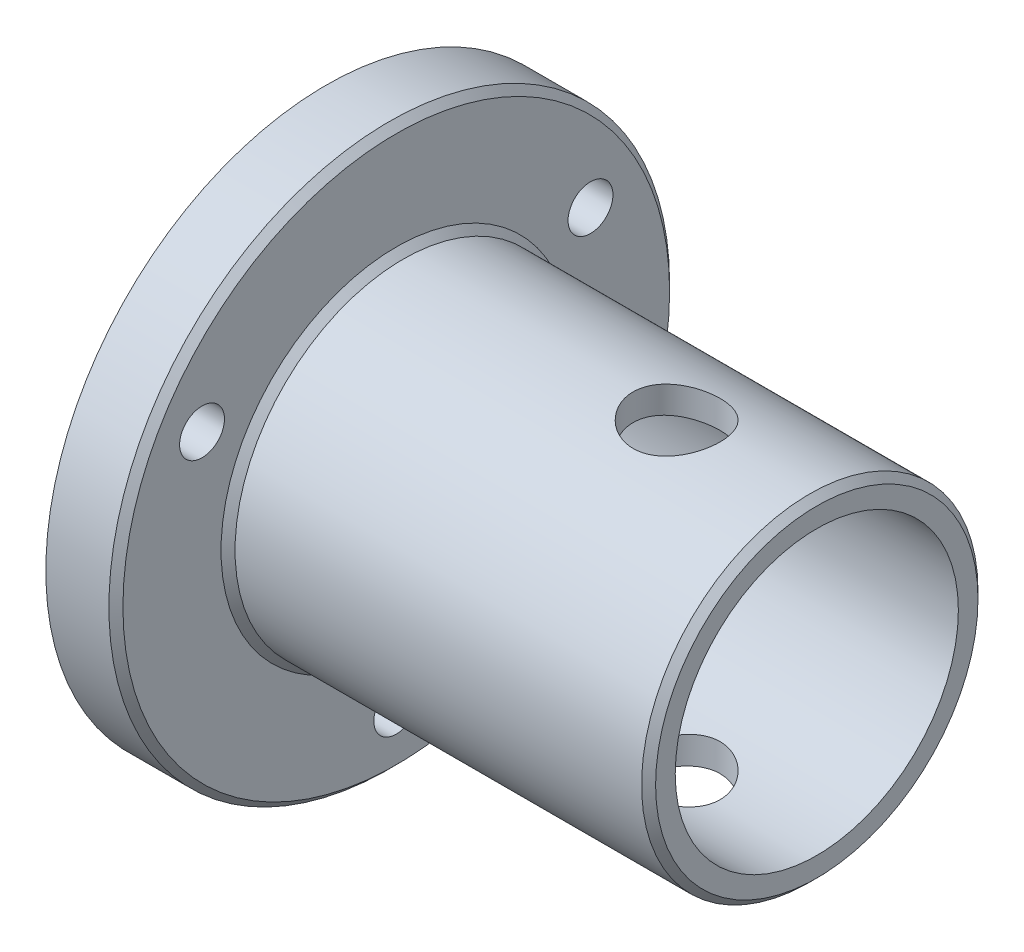
from build123d import *

# Parameters (mm, degrees)
SKETCH_1_R               = 20
EXTRUDE_1_DEPTH          = 5
SKETCH_6_R               = 12
EXTRUDE_2_DEPTH          = 30
SKETCH_7_R               = 10.1
CUT_EXTRUDE_2_DEPTH      = 30
CHAMFER_1_SIZE           = 0.5
CUT_EXTRUDE_3_DEPTH      = 46
CUT_EXTRUDE_3_DEPTH_BACK = 46
SKETCH_8_R               = 3.1
CHAMFER_2_SIZE           = 0.5
CHAMFER_3_SIZE           = 0.5
SKETCH_9_R               = 1.6
CUT_EXTRUDE_4_DEPTH      = 10


with BuildPart() as part:
    # 草图1 → 凸台-拉伸1 (new body)
    with BuildSketch(Plane(origin=(0, 0, 0), x_dir=(0, 0, -1), z_dir=(1, 0, 0))):
        Circle(SKETCH_1_R)
    extrude(amount=EXTRUDE_1_DEPTH)

    # 草图6 → 凸台-拉伸2 (add)
    with BuildSketch(Plane(origin=(5, 0, 0), x_dir=(0, 0, -1), z_dir=(1, 0, 0))):
        Circle(SKETCH_6_R)
    extrude(amount=EXTRUDE_2_DEPTH)

    # 草图7 → 切除-拉伸2 (cut)
    with BuildSketch(Plane(origin=(35, 0, 0), x_dir=(0, 0, -1), z_dir=(1, 0, 0))):
        Circle(SKETCH_7_R)
    extrude(amount=-CUT_EXTRUDE_2_DEPTH, mode=Mode.SUBTRACT)

    # 倒角1
    chamfer_1_edges = [part.edges().sort_by_distance(p)[0] for p in [
        (35, 0, 12),
    ]]
    chamfer(chamfer_1_edges, length=CHAMFER_1_SIZE)

    # 草图8 → 切除-拉伸3 (cut, two sides: drawn at the far end of the back side and taken through both)
    with BuildSketch(Plane(origin=(0, 0, 0), x_dir=(1, 0, 0), z_dir=(0, 1, 0)).offset(-CUT_EXTRUDE_3_DEPTH_BACK)):
        with Locations(Location((25, 0, 0), (0, 0, 90))):
            Circle(SKETCH_8_R)
    extrude(amount=CUT_EXTRUDE_3_DEPTH + CUT_EXTRUDE_3_DEPTH_BACK, mode=Mode.SUBTRACT)

    # 倒角2
    chamfer_2_edges = [part.edges().sort_by_distance(p)[0] for p in [
        (5, 0, 20),
    ]]
    chamfer(chamfer_2_edges, length=CHAMFER_2_SIZE)

    # 倒角3
    chamfer_3_edges = [part.edges().sort_by_distance(p)[0] for p in [
        (5, 0, 12),
    ]]
    chamfer(chamfer_3_edges, length=CHAMFER_3_SIZE)

    # 草图9 → 切除-拉伸4 (cut)
    with BuildSketch(Plane.ZY):
        with Locations((-13.856406461, 8)):
            Circle(SKETCH_9_R)
        with Locations((13.856406461, 8)):
            Circle(SKETCH_9_R)
        with Locations((0, -16)):
            Circle(SKETCH_9_R)
    extrude(amount=-CUT_EXTRUDE_4_DEPTH, mode=Mode.SUBTRACT)


solid = part.part
